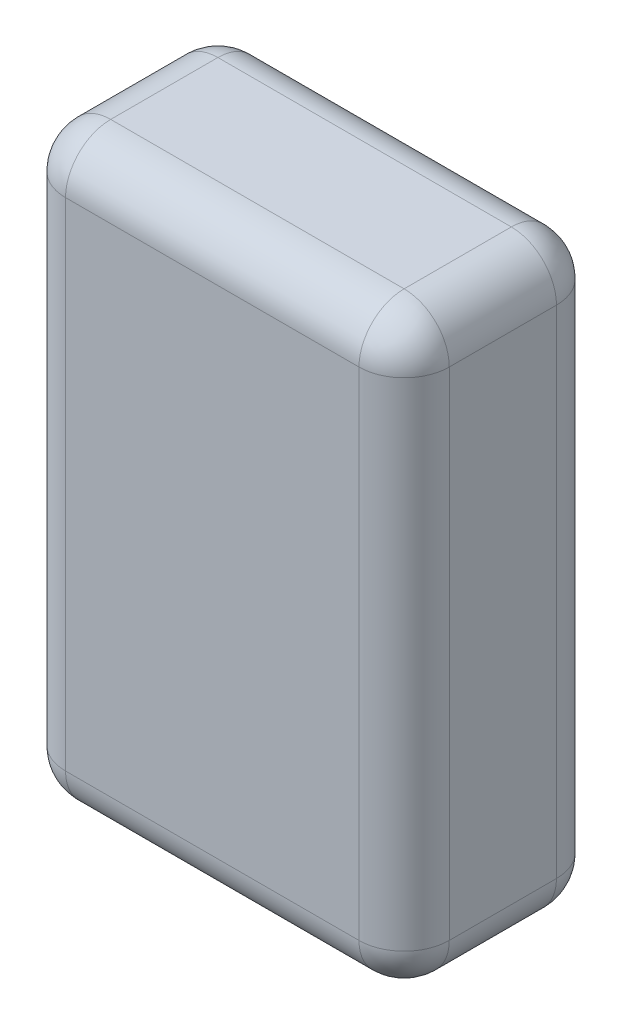
from build123d import *

# Parameters (mm, degrees)
SKETCH_1_W      = 17
SKETCH_1_H      = 26
EXTRUDE_1_DEPTH = 8.75
FILLET_1_R      = 2


with BuildPart() as part:
    # 草图1 → 凸台-拉伸1 (new body)
    with BuildSketch(Plane.XY):
        Rectangle(SKETCH_1_W, SKETCH_1_H)
    extrude(amount=EXTRUDE_1_DEPTH)

    # 圆角1
    fillet_1_edges = [part.edges().sort_by_distance(p)[0] for p in [
        (-8.5, 0, 8.75),
        (0, -13, 8.75),
        (8.5, 0, 8.75),
        (0, -13, 0),
        (-8.5, 0, 0),
        (0, 13, 0),
        (8.5, 0, 0),
        (0, 13, 8.75),
        (8.5, -13, 4.375),
        (-8.5, -13, 4.375),
        (-8.5, 13, 4.375),
        (8.5, 13, 4.375),
    ]]
    fillet(fillet_1_edges, radius=FILLET_1_R)


solid = part.part
